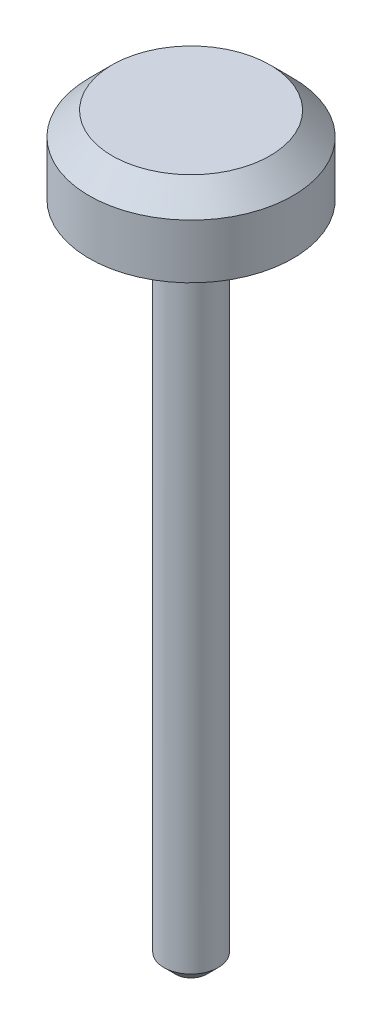
from build123d import *

# Parameters (mm, degrees)
CHAMFER3_SIZE = 1


with BuildPart() as part:
    # Sketch2 → Revolve1 (revolve)
    with BuildSketch(Plane.XY):
        Polygon((0, 22.313788144), (-7.264862559, 22.313788144), (-9.386182903, 20.192467801), (-9.386182903, 15.192467801), (-2.5, 15.192467801), (-2.5, -44.807532199), (-1.439339828, -45.868192371), (0, -45.868192371), align=None)
    revolve(axis=Axis((0, 22.313788144, 0), (0, -1, 0)))

    # Chamfer3
    chamfer3_edges = [part.edges().sort_by_distance(p)[0] for p in [
        (2.5, 15.192467801, 0),
    ]]
    chamfer(chamfer3_edges, length=CHAMFER3_SIZE)


solid = part.part
